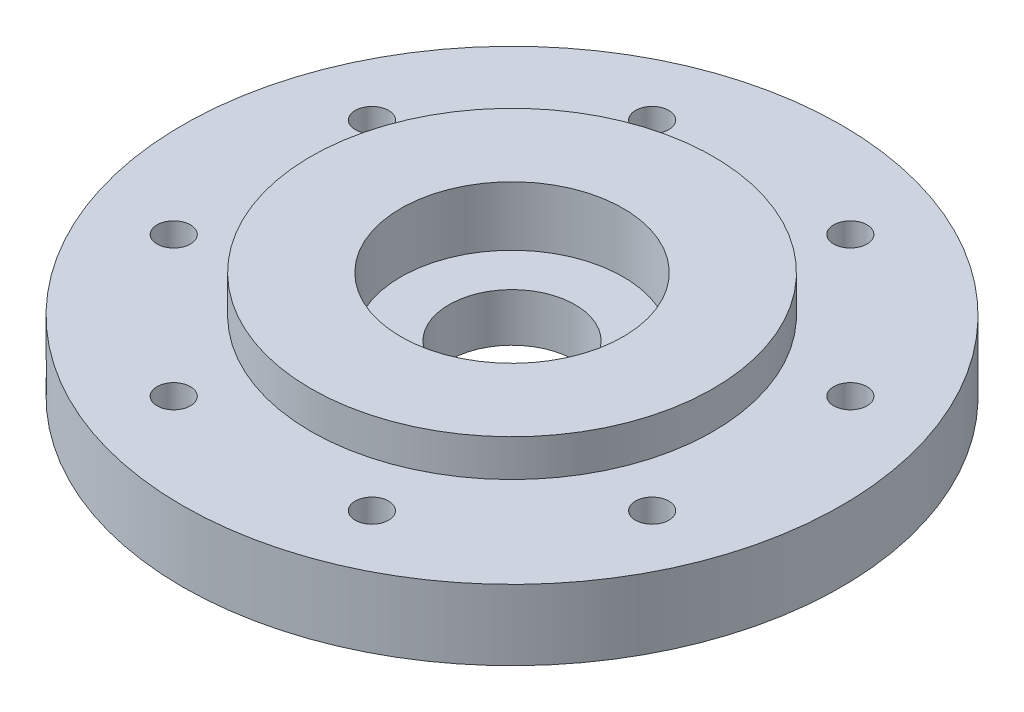
from build123d import *

# Parameters (mm, degrees)
SKETCH1_R                           = 44.45
SKETCH1_R_2                         = 8.5
BODY_AND_CENTER_HOLE_DEPTH          = 14.5
SKETCH5_R                           = 15
BIG_SEAL_CUT_DEPTH                  = 8
SKETCH6_R                           = 2.25
IMPELLER_HOUSING_BOLT_HOLES_DEPTH   = 38
IMPELLER_HOUSING_BOLT_PATTERN_COUNT = 8
IMPELLER_START                      = -5
SKETCH7_R                           = 44.45
SKETCH7_R_2                         = 27.1319
IMPELLER_RECESS_DEPTH               = 5
SKETCH8_R                           = 3
BOLT_HOLE_DEPTH                     = 7.5
BIG_BOLT_PATTERN_COUNT              = 4
PRESSURE_HOLE_DEPTH                 = 50
PRESSURE_HOLE_DEPTH_BACK            = 10
SKETCH9_R                           = 1
SKETCH12_R                          = 2.5
PRESSURE_TAP_FITTING_BORE_DEPTH     = 8


with BuildPart() as part:
    # Sketch1 → body and center hole (new body)
    with BuildSketch(Plane(origin=(0, 0, 0), x_dir=(1, 0, 0), z_dir=(0, 1, 0))):
        with Locations(Location((0, 0, 0), (0, 0, 90))):
            Circle(SKETCH1_R)
        with Locations(Location((0, 0, 0), (0, 0, 90))):
            Circle(SKETCH1_R_2, mode=Mode.SUBTRACT)
    extrude(amount=BODY_AND_CENTER_HOLE_DEPTH)

    # Sketch5 → big seal cut (cut)
    with BuildSketch(Plane(origin=(0, 14.5, 0), x_dir=(1, 0, 0), z_dir=(0, 1, 0))):
        with Locations(Location((0, 0, 0), (0, 0, 270))):
            Circle(SKETCH5_R)
    extrude(amount=-BIG_SEAL_CUT_DEPTH, mode=Mode.SUBTRACT)

    # Sketch6 → impeller housing bolt holes (cut)
    with BuildSketch(Plane(origin=(0, 14.5, 0), x_dir=(1, 0, 0), z_dir=(0, 1, 0))):
        with Locations(Location((13.365218875, 32.266492673, 0), (0, 0, 270))):
            Circle(SKETCH6_R)
    impeller_housing_bolt_holes = extrude(amount=-IMPELLER_HOUSING_BOLT_HOLES_DEPTH, mode=Mode.SUBTRACT)

    # impeller housing bolt pattern: impeller housing bolt holes ×8 about axis
    impeller_housing_bolt_pattern_axis = Axis((0, 0, 0), (0, 1, 0))
    for i in range(1, IMPELLER_HOUSING_BOLT_PATTERN_COUNT):
        add(impeller_housing_bolt_holes.rotate(impeller_housing_bolt_pattern_axis, i * 360 / IMPELLER_HOUSING_BOLT_PATTERN_COUNT), mode=Mode.SUBTRACT)

    # Sketch7 → impeller recess (cut)
    with BuildSketch(Plane(origin=(0, 14.5, 0), x_dir=(1, 0, 0), z_dir=(0, 1, 0)).offset(IMPELLER_START)):
        with Locations(Location((0, 0, 0), (0, 0, 90))):
            Circle(SKETCH7_R)
        with Locations(Location((0, 0, 0), (0, 0, 270))):
            Circle(SKETCH7_R_2, mode=Mode.SUBTRACT)
    extrude(amount=IMPELLER_RECESS_DEPTH, mode=Mode.SUBTRACT)

    # Sketch8 → bolt hole (cut)
    with BuildSketch(Plane(origin=(0, 0, 0), x_dir=(-1, 0, 0), z_dir=(0, -1, 0))):
        with Locations(Location((0, -25.4, 0), (0, 0, 90))):
            Circle(SKETCH8_R)
    bolt_hole = extrude(amount=-BOLT_HOLE_DEPTH, mode=Mode.SUBTRACT)

    # big bolt pattern: bolt hole ×4 about axis
    big_bolt_pattern_axis = Axis((0, 0, 0), (0, 1, 0))
    for i in range(1, BIG_BOLT_PATTERN_COUNT):
        add(bolt_hole.rotate(big_bolt_pattern_axis, i * 360 / BIG_BOLT_PATTERN_COUNT), mode=Mode.SUBTRACT)

    # Sketch9 → pressure hole (cut, two sides: drawn at the far end of the back side and taken through both)
    with BuildSketch(Plane(origin=(-10.578679656, 0, 10.578679656), x_dir=(0.7071067811865513, 0, 0.7071067811865438), z_dir=(-0.7071067811865438, 0, 0.7071067811865513)).offset(-PRESSURE_HOLE_DEPTH_BACK)):
        with Locations(Location((0, 3.25, 0), (0, 0, 180))):
            Circle(SKETCH9_R)
    extrude(amount=PRESSURE_HOLE_DEPTH + PRESSURE_HOLE_DEPTH_BACK, mode=Mode.SUBTRACT)

    # Sketch12 → pressure tap fitting bore (cut)
    with BuildSketch(Plane(origin=(-31.430896424, 0, 31.430896424), x_dir=(0.7071067811865512, 0, 0.7071067811865438), z_dir=(-0.7071067811865438, 0, 0.7071067811865512))):
        with Locations((0, 3.25)):
            Circle(SKETCH12_R)
    extrude(amount=-PRESSURE_TAP_FITTING_BORE_DEPTH, mode=Mode.SUBTRACT)


solid = part.part
